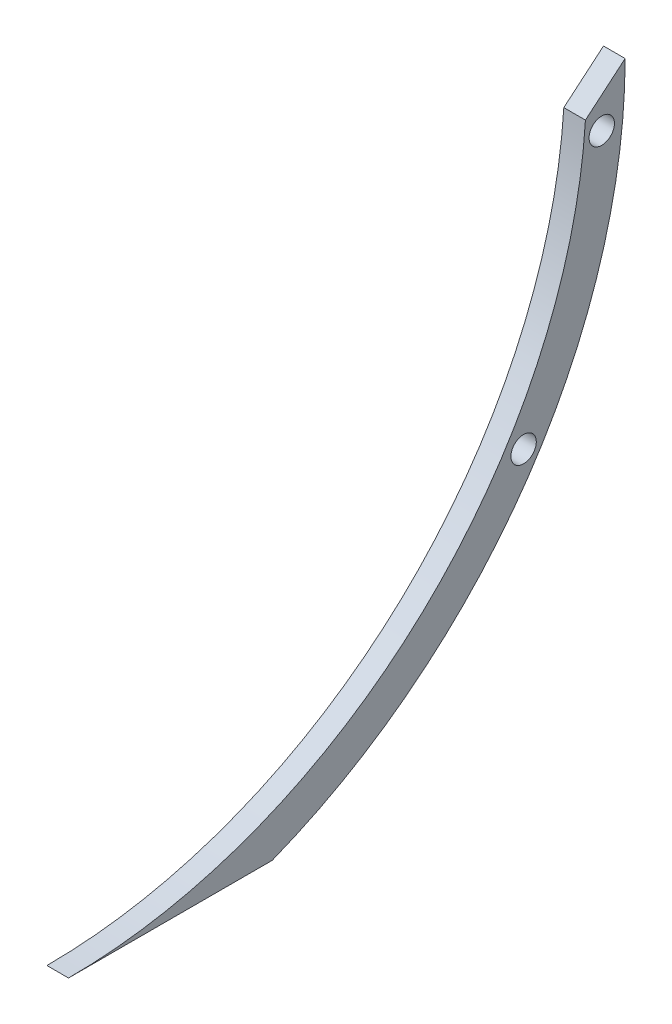
from build123d import *

# Parameters (mm, degrees)
SKETCH1_R           = 3.175
BOSS_EXTRUDE2_DEPTH = 5.4102
CUT_EXTRUDE1_DEPTH  = 5.4102


with BuildPart() as part:
    # Sketch1 → Boss-Extrude2 (new body)
    with BuildSketch(Plane(origin=(0, 0, 0), x_dir=(0, 0, -1), z_dir=(1, 0, 0))):
        with BuildLine():
            ThreePointArc((109.510185389, -69.196321406), (62.517678, -113.455504659), (0, -129.54))
            Line((0, -129.54), (50.929375256, -129.54))
            ThreePointArc((50.929375256, -129.54), (115.029071249, -78.375542305), (139.192, 0))
            Line((139.192, 0), (129.54, 0))
            ThreePointArc((129.54, 0), (124.431830765, -36.01848265), (109.510185389, -69.196321406))
        make_face()
        with BuildLine():
            ThreePointArc((116.979702463, -71.909902638), (112.921896515, -74.959702412), (111.120629291, -70.213914368))
            ThreePointArc((111.120629291, -70.213914368), (114.68750841, -68.860102864), (116.979702463, -71.909902638))
        make_face(mode=Mode.SUBTRACT)
        with Locations((133.35, -12.7)):
            Circle(SKETCH1_R, mode=Mode.SUBTRACT)
    extrude(amount=BOSS_EXTRUDE2_DEPTH)

    # Sketch2 → Cut-Extrude1 (cut)
    with BuildSketch(Plane(origin=(5.4102, 0, 0), x_dir=(0, 0, -1), z_dir=(1, 0, 0))):
        Polygon((139.192, 0), (129.268805309, -8.37780246), (129.54, 0), align=None)
    extrude(amount=-CUT_EXTRUDE1_DEPTH, mode=Mode.SUBTRACT)


solid = part.part
